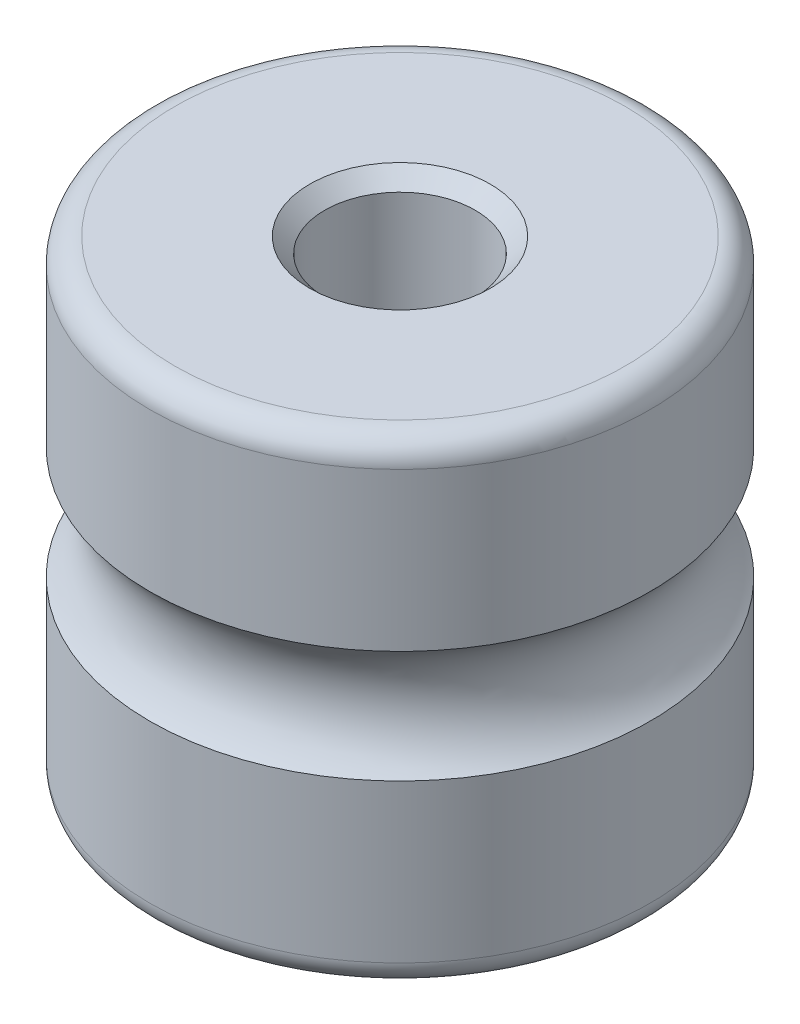
from build123d import *

# Parameters (mm, degrees)
SKETCH_1_R          = 49.855
EXTRUDE_1_DEPTH     = 95.18
SKETCH_3_R          = 15
SKETCH_4_R          = 15
CUT_EXTRUDE_1_DEPTH = 250
CHAMFER_1_SIZE      = 3
FILLET_1_R          = 5


with BuildPart() as part:
    # 草图1 → 凸台-拉伸1 (new body)
    with BuildSketch(Plane(origin=(0, 513.97, 0), x_dir=(1, 0, 0), z_dir=(0, 1, 0))):
        with Locations(Location((-989.291415846, 54.73, 0), (0, 0, 90))):
            Circle(SKETCH_1_R)
    extrude(amount=EXTRUDE_1_DEPTH)

    # 草图3 → 切除-旋转1 (revolve, cut)
    with BuildSketch(Plane.XY.offset(-54.73), mode=Mode.PRIVATE) as cut_revolve_1_sk:
        with Locations((-1049.146415846, 561.56)):
            Circle(SKETCH_3_R)
    revolve(cut_revolve_1_sk.sketch.rotate(Axis((-989.291415846, 609.15, -54.73), (0, -1, 0)), 90), axis=Axis((-989.291415846, 609.15, -54.73), (0, -1, 0)), mode=Mode.SUBTRACT)

    # 草图4 → 切除-拉伸1 (cut, symmetric)
    with BuildSketch(Plane(origin=(0, 609.15, 0), x_dir=(1, 0, 0), z_dir=(0, 1, 0))):
        with Locations(Location((-989.291415846, 54.73, 0), (0, 0, 270))):
            Circle(SKETCH_4_R)
    extrude(amount=CUT_EXTRUDE_1_DEPTH, both=True, mode=Mode.SUBTRACT)

    # 倒角1
    chamfer_1_edges = [part.edges().sort_by_distance(p)[0] for p in [
        (-989.291415846, 609.15, -69.73),
        (-989.291415846, 513.97, -69.73),
    ]]
    chamfer(chamfer_1_edges, length=CHAMFER_1_SIZE)

    # 圆角1
    fillet_1_edges = [part.edges().sort_by_distance(p)[0] for p in [
        (-989.291415846, 513.97, -4.875),
        (-989.291415846, 609.15, -4.875),
    ]]
    fillet(fillet_1_edges, radius=FILLET_1_R)


solid = part.part
